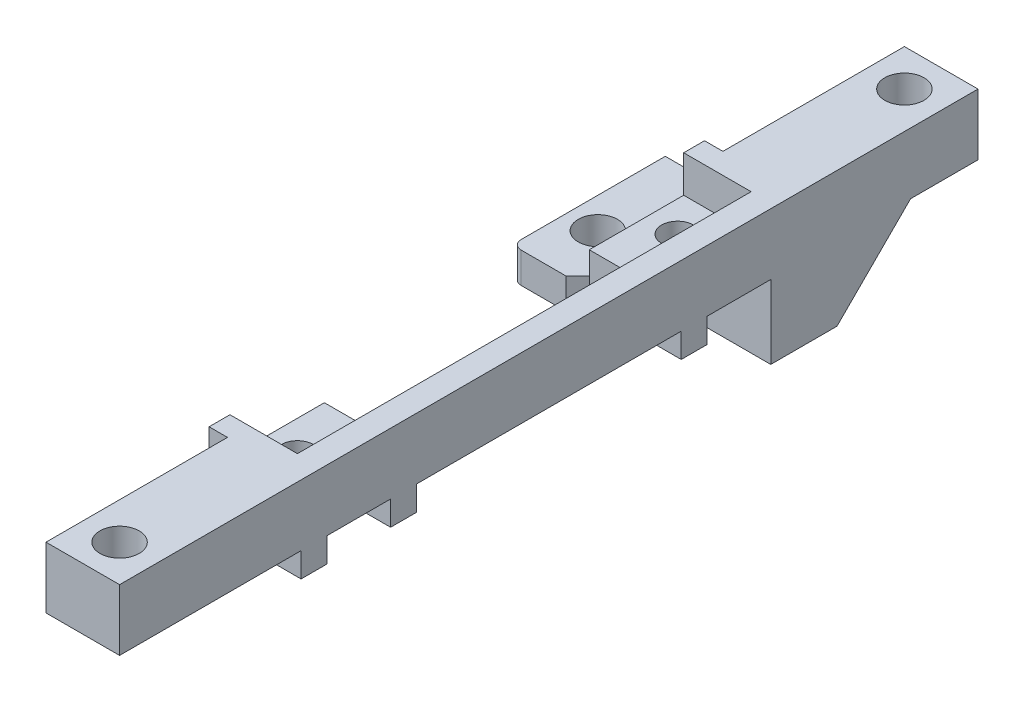
from build123d import *

# Parameters (mm, degrees)
SKETCH1_W           = 6
SKETCH1_H           = 70
BOSS_EXTRUDE1_DEPTH = 5
SKETCH2_R           = 1.6
CUT_EXTRUDE1_DEPTH  = 36.482389998
SKETCH5_W           = 1.5
SKETCH5_H           = 40.4
BOSS_EXTRUDE2_DEPTH = 5
SKETCH7_W           = 14.889639403
SKETCH7_H           = 37
CUT_EXTRUDE5_DEPTH  = 3
SKETCH8_W           = 4
SKETCH8_H           = 21.6
CUT_EXTRUDE6_DEPTH  = 3
SKETCH9_W           = 16.5
SKETCH9_H           = 10
BOSS_EXTRUDE3_DEPTH = 6
SKETCH6_R           = 1.3
CUT_EXTRUDE4_DEPTH  = 40.092838219
SKETCH10_R          = 1.6
CUT_EXTRUDE7_DEPTH  = 9
CUT_EXTRUDE8_DEPTH  = 3.5
BOSS_EXTRUDE4_DEPTH = 6
CUT_EXTRUDE10_REACH = 41.093
BOSS_EXTRUDE5_DEPTH = 10.5
FILLET3_R           = 0.75
SKETCH16_W          = 7.5
SKETCH16_H          = 2.1
BOSS_EXTRUDE6_DEPTH = 2


with BuildPart() as part:
    # Sketch1 → Boss-Extrude1 (new body)
    with BuildSketch(Plane(origin=(0, 0, 0), x_dir=(1, 0, 0), z_dir=(0, 1, 0))):
        Rectangle(SKETCH1_W, SKETCH1_H)
    extrude(amount=BOSS_EXTRUDE1_DEPTH)

    # Sketch2 → Cut-Extrude1 (cut, through all)
    with BuildSketch(Plane(origin=(0, 5, 0), x_dir=(1, 0, 0), z_dir=(0, 1, 0))):
        with Locations(Location((0, -32, 0), (0, 0, 270))):
            Circle(SKETCH2_R)
        with Locations(Location((0, 32, 0), (0, 0, 270))):
            Circle(SKETCH2_R)
    extrude(amount=-CUT_EXTRUDE1_DEPTH, mode=Mode.SUBTRACT)

    # Sketch5 → Boss-Extrude2 (add)
    with BuildSketch(Plane(origin=(0, 5, 0), x_dir=(1, 0, 0), z_dir=(0, 1, 0))):
        with Locations((-3.75, 0)):
            Rectangle(SKETCH5_W, SKETCH5_H)
    extrude(amount=-BOSS_EXTRUDE2_DEPTH)

    # Sketch7 → Cut-Extrude5 (cut)
    with BuildSketch(Plane(origin=(0, 5, 0), x_dir=(1, 0, 0), z_dir=(0, 1, 0))):
        with Locations((-6.444819702, 0)):
            Rectangle(SKETCH7_W, SKETCH7_H)
    extrude(amount=-CUT_EXTRUDE5_DEPTH, mode=Mode.SUBTRACT)

    # Sketch8 → Cut-Extrude6 (cut)
    with BuildSketch(Plane(origin=(0, 2, 0), x_dir=(1, 0, 0), z_dir=(0, 1, 0))):
        with Locations((-2.5, 0)):
            Rectangle(SKETCH8_W, SKETCH8_H)
    extrude(amount=-CUT_EXTRUDE6_DEPTH, mode=Mode.SUBTRACT)

    # Sketch9 → Boss-Extrude3 (add)
    with BuildSketch(Plane.XZ):
        with Locations((-5.25, -18.5)):
            Rectangle(SKETCH9_W, SKETCH9_H)
    extrude(amount=BOSS_EXTRUDE3_DEPTH)

    # Sketch6 → Cut-Extrude4 (cut, through all)
    with BuildSketch(Plane(origin=(0, 5, 0), x_dir=(1, 0, 0), z_dir=(0, 1, 0))):
        with Locations(Location((-2, 15.5, 0), (0, 0, 90))):
            Circle(SKETCH6_R)
        with Locations(Location((-2, -15.5, 0), (0, 0, 270))):
            Circle(SKETCH6_R)
    extrude(amount=-CUT_EXTRUDE4_DEPTH, mode=Mode.SUBTRACT)

    # Sketch10 → Cut-Extrude7 (cut)
    with BuildSketch(Plane(origin=(0, 0, 0), x_dir=(1, 0, 0), z_dir=(0, 1, 0))):
        with Locations(Location((-11, 18, 0), (0, 0, 270))):
            Circle(SKETCH10_R)
    extrude(amount=-CUT_EXTRUDE7_DEPTH, mode=Mode.SUBTRACT)

    # Sketch11 → Cut-Extrude8 (cut)
    with BuildSketch(Plane(origin=(0, 0, 0), x_dir=(1, 0, 0), z_dir=(0, 1, 0))):
        Polygon((-13.5, 13.5), (-4.5, 13.5), (-4.5, 20.2), (-3, 20.2), (-3, 23.5), (-13.5, 23.5), align=None)
    extrude(amount=-CUT_EXTRUDE8_DEPTH, mode=Mode.SUBTRACT)

    # Sketch13 → Boss-Extrude4 (add)
    with BuildSketch(Plane(origin=(3, 0, 0), x_dir=(0, 0, -1), z_dir=(1, 0, 0))):
        Polygon((23.5, -6), (29.5, 0), (23.5, 0), align=None)
    extrude(amount=-BOSS_EXTRUDE4_DEPTH)

    # Cut-Extrude10: up to this face of the body (flat: up to its plane)
    cut_extrude10_end = Plane(part.part.faces().sort_by_distance((0.153252085, 0, 12.233088701))[0])
    # Sketch14 → Cut-Extrude10 (cut, up to the picked face)
    with BuildSketch(Plane.XZ.offset(6), mode=Mode.PRIVATE) as cut_extrude10_sk1:
        Polygon((-4.5, -18.1), (5.195583007, -18.1), (5.195583007, -13.5), (-9.1, -13.5), align=None)
    cut_extrude10_tool1 = split(extrude(cut_extrude10_sk1.sketch, amount=-CUT_EXTRUDE10_REACH, mode=Mode.PRIVATE), bisect_by=cut_extrude10_end, keep=Keep.BOTH, mode=Mode.PRIVATE)
    add(cut_extrude10_tool1.solids().sort_by(Axis((-0.875708, -6, -15.653001), (0, 1, 0)))[0], mode=Mode.SUBTRACT)

    # Sketch15 → Boss-Extrude5 (add)
    with BuildSketch(Plane.ZY.offset(3)):
        Polygon((-23.5, -3.5), (-23.5, -6), (-26, -3.5), align=None)
    extrude(amount=BOSS_EXTRUDE5_DEPTH)

    # Fillet3
    fillet3_edges = [part.edges().sort_by_distance(p)[0] for p in [
        (-13.5, -4.75, -13.5),
    ]]
    fillet(fillet3_edges, radius=FILLET3_R)

    # Sketch16 → Boss-Extrude6 (add)
    with BuildSketch(Plane.XZ):
        with Locations((-0.75, -19.15)):
            Rectangle(SKETCH16_W, SKETCH16_H)
        with Locations((-0.75, -11.85)):
            Rectangle(SKETCH16_W, SKETCH16_H)
        with Locations((-0.75, 11.85)):
            Rectangle(SKETCH16_W, SKETCH16_H)
        with Locations((-0.75, 19.15)):
            Rectangle(SKETCH16_W, SKETCH16_H)
    extrude(amount=BOSS_EXTRUDE6_DEPTH)


solid = part.part
